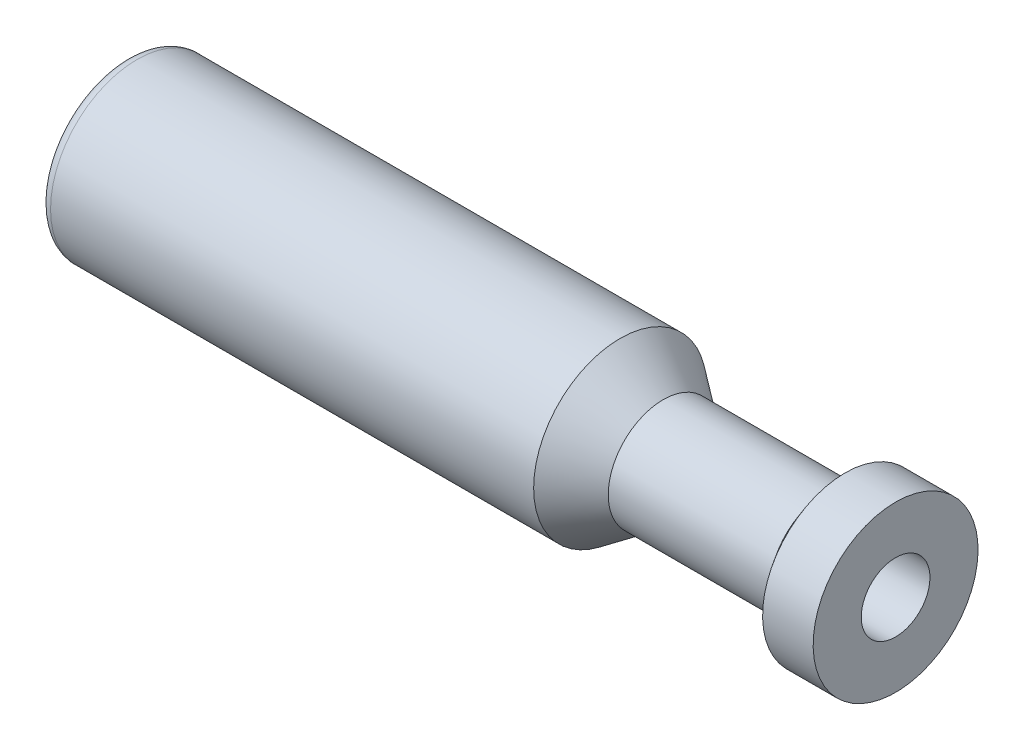
from build123d import *

# Parameters (mm, degrees)
SKETCH4_R          = 7.9375
CUT_EXTRUDE1_DEPTH = 190.5
FILLET1_R          = 2.54


with BuildPart() as part:
    # Sketch1 → Revolve1 (revolve)
    with BuildSketch(Plane.XY):
        Polygon((107.503032851, -34.960925594), (117.452183803, -42.243603137), (154.81866926, -42.243603137), (159.466804827, -35.893603137), (171.145497316, -35.893603137), (171.145497316, -54.943603137), (-6.654502684, -54.943603137), (-6.654502684, -34.960925594), align=None)
    revolve(axis=Axis((171.145497316, -54.943603137, 0), (-1, 0, 0)))

    # Sketch4 → Cut-Extrude1 (cut)
    with BuildSketch(Plane(origin=(171.145497316, 0, 0), x_dir=(0, 0, -1), z_dir=(1, 0, 0))):
        with Locations(Location((0, -54.943603137, 0), (0, 0, 90))):
            Circle(SKETCH4_R)
    extrude(amount=-CUT_EXTRUDE1_DEPTH, mode=Mode.SUBTRACT)

    # Fillet1
    fillet1_edges = [part.edges().sort_by_distance(p)[0] for p in [
        (-6.654502684, -74.926280681, 0),
    ]]
    fillet(fillet1_edges, radius=FILLET1_R)


solid = part.part
